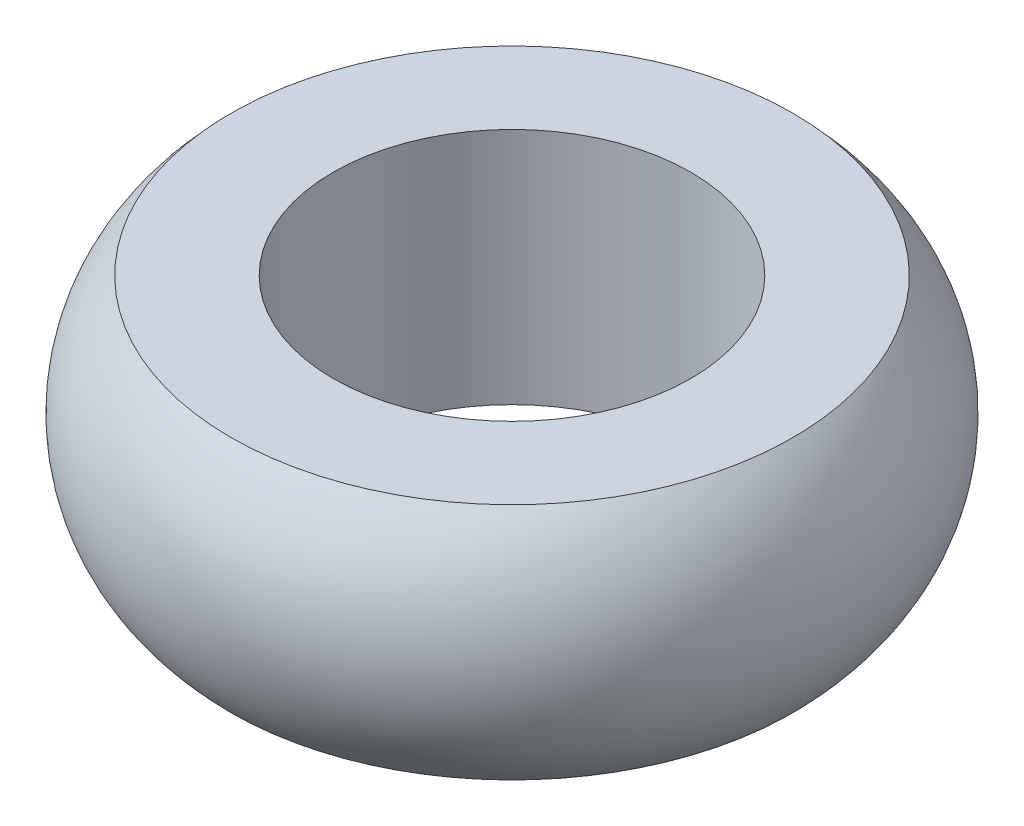
from build123d import *


with BuildPart() as part:
    # Sketch1 → Revolve1 (revolve)
    with BuildSketch(Plane.XY, mode=Mode.PRIVATE) as revolve1_sk:
        with BuildLine():
            Line((-5.25, 7), (-5.25, 0))
            Line((-5.25, 0), (-8.25, 0))
            ThreePointArc((-8.25, 0), (-9.679285786, 3.5), (-8.25, 7))
            Line((-8.25, 7), (-5.25, 7))
        make_face()
    revolve(revolve1_sk.sketch.rotate(Axis((0, 0, 0), (0, 1, 0)), 270), axis=Axis((0, 0, 0), (0, 1, 0)))


solid = part.part
